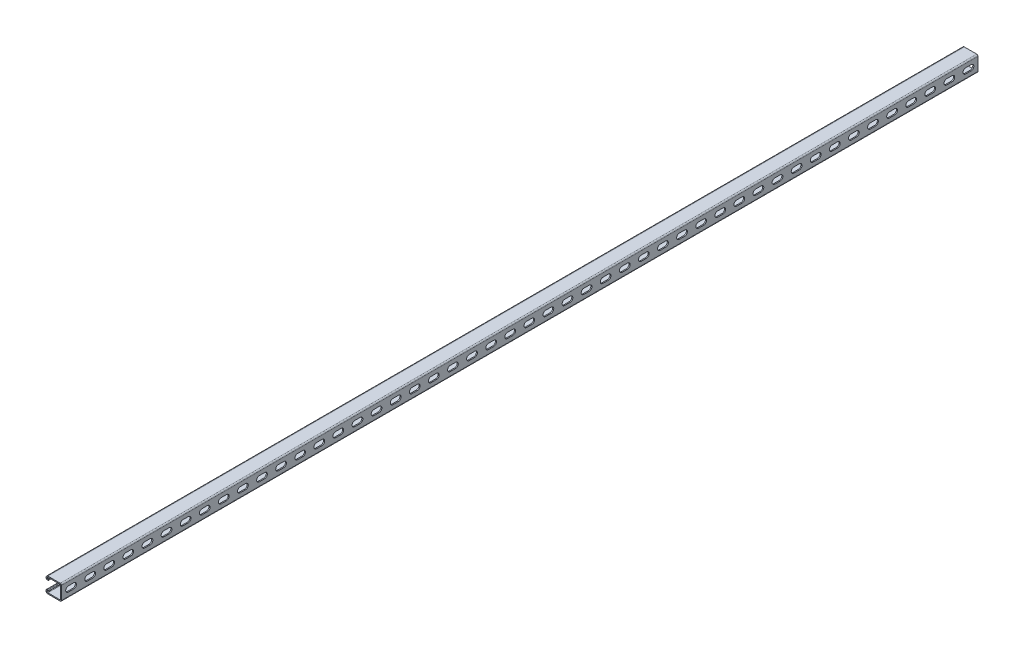
from build123d import *

# Parameters (mm, degrees)
BOSS_EXTRUDE1_DEPTH = 2438.4
CUT_EXTRUDE1_DEPTH  = 2.794
LPATTERN1_COUNT     = 48
LPATTERN1_PITCH     = 50.8


with BuildPart() as part:
    # Sketch1 → Boss-Extrude1 (new body)
    with BuildSketch(Plane.XY):
        with BuildLine():
            Line((-36.22675, 20.6375), (-3.46075, 20.6375))
            ThreePointArc((-3.46075, 20.6375), (-1.013630207, 19.623869793), (0, 17.17675))
            Line((0, 17.17675), (0, -17.17675))
            ThreePointArc((0, -17.17675), (-1.013630207, -19.623869793), (-3.46075, -20.6375))
            Line((-3.46075, -20.6375), (-36.22675, -20.6375))
            ThreePointArc((-36.22675, -20.6375), (-39.796401808, -19.158901808), (-41.275, -15.58925))
            Line((-41.275, -15.58925), (-41.275, -14.57325))
            ThreePointArc((-41.275, -14.57325), (-40.261369793, -12.126130207), (-37.81425, -11.1125))
            Line((-37.81425, -11.1125), (-35.5346, -11.1125))
            ThreePointArc((-35.5346, -11.1125), (-34.1376, -12.5095), (-35.5346, -13.9065))
            Line((-35.5346, -13.9065), (-37.81425, -13.9065))
            ThreePointArc((-37.81425, -13.9065), (-38.285713446, -14.101786554), (-38.481, -14.57325))
            Line((-38.481, -14.57325), (-38.481, -15.58925))
            ThreePointArc((-38.481, -15.58925), (-37.820745461, -17.183245461), (-36.22675, -17.8435))
            Line((-36.22675, -17.8435), (-3.46075, -17.8435))
            ThreePointArc((-3.46075, -17.8435), (-2.989286554, -17.648213446), (-2.794, -17.17675))
            Line((-2.794, -17.17675), (-2.794, 17.17675))
            ThreePointArc((-2.794, 17.17675), (-2.989286554, 17.648213446), (-3.46075, 17.8435))
            Line((-3.46075, 17.8435), (-36.22675, 17.8435))
            ThreePointArc((-36.22675, 17.8435), (-37.820745461, 17.183245461), (-38.481, 15.58925))
            Line((-38.481, 15.58925), (-38.481, 14.57325))
            ThreePointArc((-38.481, 14.57325), (-38.285713446, 14.101786554), (-37.81425, 13.9065))
            Line((-37.81425, 13.9065), (-35.5346, 13.9065))
            ThreePointArc((-35.5346, 13.9065), (-34.1376, 12.5095), (-35.5346, 11.1125))
            Line((-35.5346, 11.1125), (-37.81425, 11.1125))
            ThreePointArc((-37.81425, 11.1125), (-40.261369793, 12.126130207), (-41.275, 14.57325))
            Line((-41.275, 14.57325), (-41.275, 15.58925))
            ThreePointArc((-41.275, 15.58925), (-39.796401808, 19.158901808), (-36.22675, 20.6375))
        make_face()
    extrude(amount=-BOSS_EXTRUDE1_DEPTH)

    # Sketch2 → Cut-Extrude1 (cut)
    with BuildSketch(Plane(origin=(0, 0, 0), x_dir=(0, 0, -1), z_dir=(1, 0, 0))):
        with BuildLine():
            Line((18.25625, 7.14375), (32.54375, 7.14375))
            ThreePointArc((32.54375, 7.14375), (39.6875, 0), (32.54375, -7.14375))
            Line((32.54375, -7.14375), (18.25625, -7.14375))
            ThreePointArc((18.25625, -7.14375), (11.1125, 0), (18.25625, 7.14375))
        make_face()
    cut_extrude1 = extrude(amount=-CUT_EXTRUDE1_DEPTH, mode=Mode.SUBTRACT)

    # LPattern1: Cut-Extrude1 ×48
    with Locations(*[(0, 0, -i * LPATTERN1_PITCH) for i in range(1, LPATTERN1_COUNT)]):
        add(cut_extrude1, mode=Mode.SUBTRACT)


solid = part.part
